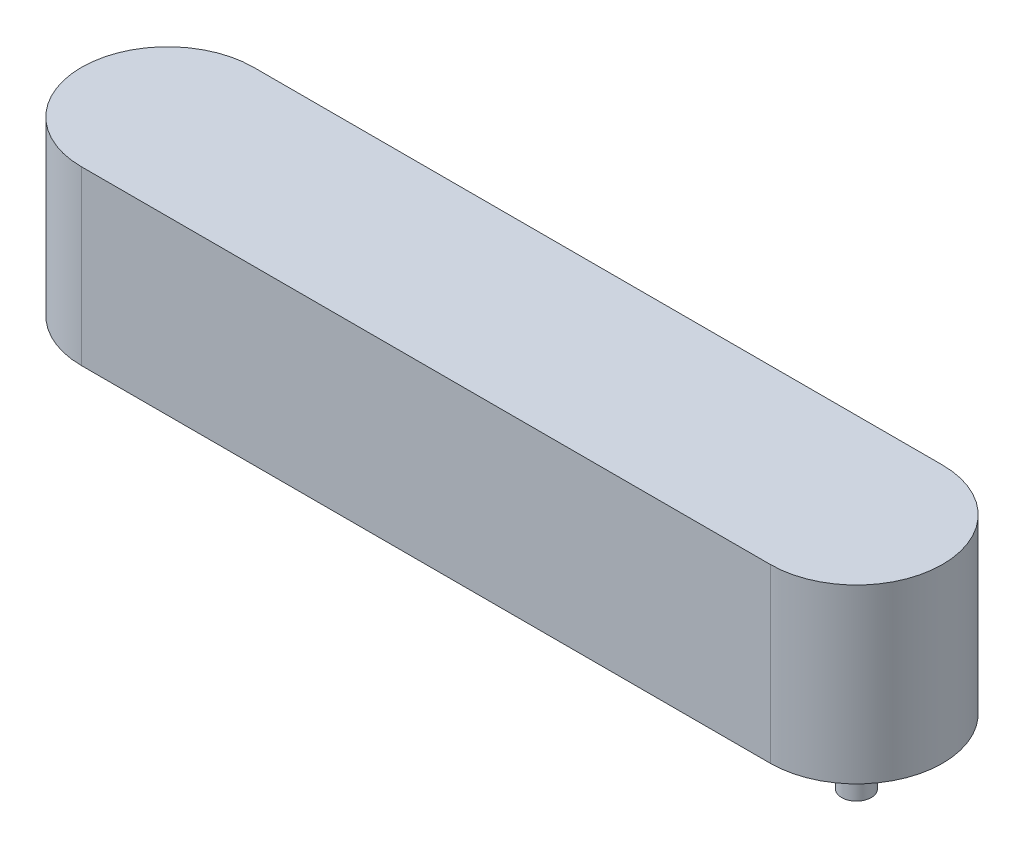
from build123d import *

# Parameters (mm, degrees)
SKIZZE1_W                       = 14.5
SKIZZE1_H                       = 2.9
AUFSATZ_LINEAR_AUSTRAGEN1_DEPTH = 1.45
VERRUNDUNG1_RADIUS              = 1.45
VERRUNDUNG1_LENGTH              = 2.9
VERRUNDUNG2_RADIUS              = 1.45
VERRUNDUNG2_LENGTH              = 2.9
SKIZZE2_R                       = 0.25
AUFSATZ_LINEAR_AUSTRAGEN2_DEPTH = 1.1


with BuildPart() as part:
    # Skizze1 → Aufsatz-Linear austragen1 (new, symmetric)
    with BuildSketch(Plane.XY):
        Rectangle(SKIZZE1_W, SKIZZE1_H)
    extrude(amount=AUFSATZ_LINEAR_AUSTRAGEN1_DEPTH, both=True)

    # Verrundung1: full round fillet: the end face becomes a half cylinder, R = half its width
    verrundung1_face = Plane((7.25, 0, 0), x_dir=(0, -1, 0), z_dir=(1, 0, 0))  # on the end face: x along it, z out of the body
    verrundung1_slab = verrundung1_face.offset(-VERRUNDUNG1_RADIUS / 2) * Box(VERRUNDUNG1_LENGTH, 2 * VERRUNDUNG1_RADIUS, VERRUNDUNG1_RADIUS, mode=Mode.PRIVATE)  # the body's end, R deep
    verrundung1_round = Plane((5.8, 0, 0), x_dir=(1, 0, 0), z_dir=(0, -1, 0)) * Cylinder(VERRUNDUNG1_RADIUS, VERRUNDUNG1_LENGTH, mode=Mode.PRIVATE)  # its axis R under the face
    add(verrundung1_slab - verrundung1_round, mode=Mode.SUBTRACT)

    # Verrundung2: full round fillet: the end face becomes a half cylinder, R = half its width
    verrundung2_face = Plane((-7.25, 0, 0), x_dir=(0, 1, 0), z_dir=(-1, 0, 0))  # on the end face: x along it, z out of the body
    verrundung2_slab = verrundung2_face.offset(-VERRUNDUNG2_RADIUS / 2) * Box(VERRUNDUNG2_LENGTH, 2 * VERRUNDUNG2_RADIUS, VERRUNDUNG2_RADIUS, mode=Mode.PRIVATE)  # the body's end, R deep
    verrundung2_round = Plane((-5.8, 0, 0), x_dir=(-1, 0, 0), z_dir=(0, 1, 0)) * Cylinder(VERRUNDUNG2_RADIUS, VERRUNDUNG2_LENGTH, mode=Mode.PRIVATE)  # its axis R under the face
    add(verrundung2_slab - verrundung2_round, mode=Mode.SUBTRACT)

    # Skizze2 → Aufsatz-Linear austragen2 (add)
    with BuildSketch(Plane.XZ.offset(1.45)):
        with Locations(Location((-5.8, 0, 0), (0, 0, 90))):
            Circle(SKIZZE2_R)
        with Locations(Location((5.8, 0, 0), (0, 0, 90))):
            Circle(SKIZZE2_R)
    extrude(amount=AUFSATZ_LINEAR_AUSTRAGEN2_DEPTH)


solid = part.part
